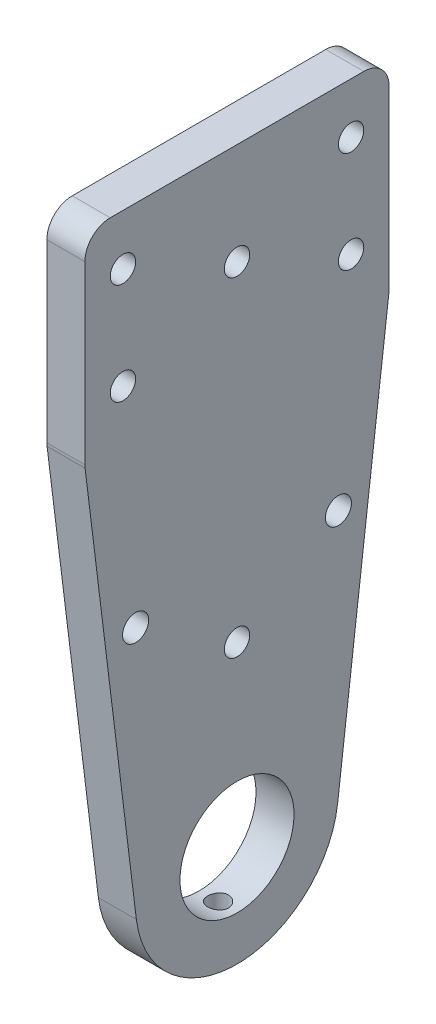
from build123d import *

# Parameters (mm, degrees)
BOSS_EXTRUDE1_START     = -38.1
SKETCH1_R               = 14.2875
SKETCH1_R_2             = 3.175
SKETCH1_R_3             = 3.2639
BOSS_EXTRUDE1_DEPTH     = 9.525
CUT_EXTRUDE1_REACH      = 194.229
CUT_EXTRUDE1_END_RADIUS = 14.2875
SKETCH2_R               = 2.6035
FILLET1_R               = 6.35


with BuildPart() as part:
    # Sketch1 → Boss-Extrude1 (new body)
    with BuildSketch(Plane(origin=(0, 0, 0), x_dir=(0, 0, -1), z_dir=(1, 0, 0)).offset(BOSS_EXTRUDE1_START)):
        with BuildLine():
            Line((-42.525623825, 632.652514423), (-55.415953018, 737.356140976))
            Line((-55.415953018, 737.356140976), (-55.415953018, 788.156140976))
            Line((-55.415953018, 788.156140976), (20.784046982, 788.156140976))
            Line((20.784046982, 788.156140976), (20.784046982, 737.356140976))
            Line((20.784046982, 737.356140976), (7.89371779, 632.652514423))
            ThreePointArc((7.89371779, 632.652514423), (-17.315953018, 610.356140976), (-42.525623825, 632.652514423))
        make_face()
        with Locations((-17.315953018, 635.756140976)):
            Circle(SKETCH1_R, mode=Mode.SUBTRACT)
        with Locations((-45.890953018, 775.456140976)):
            Circle(SKETCH1_R_2, mode=Mode.SUBTRACT)
        with Locations((-17.315953018, 762.756140976)):
            Circle(SKETCH1_R_2, mode=Mode.SUBTRACT)
        with Locations((-45.890953018, 750.056140976)):
            Circle(SKETCH1_R_2, mode=Mode.SUBTRACT)
        with Locations((11.259046982, 750.056140976)):
            Circle(SKETCH1_R_2, mode=Mode.SUBTRACT)
        with Locations((11.259046982, 775.456140976)):
            Circle(SKETCH1_R_2, mode=Mode.SUBTRACT)
        with Locations((8.084046982, 696.081140976)):
            Circle(SKETCH1_R_3, mode=Mode.SUBTRACT)
        with Locations((-17.315953018, 680.206140976)):
            Circle(SKETCH1_R_2, mode=Mode.SUBTRACT)
        with Locations((-42.715953018, 696.081140976)):
            Circle(SKETCH1_R_3, mode=Mode.SUBTRACT)
    extrude(amount=-BOSS_EXTRUDE1_DEPTH)

    # Cut-Extrude1: up to this cylinder (the profile starts outside it)
    cut_extrude1_end = Plane(origin=(-42.8625, 635.756140976, 17.315953018), z_dir=(1, 0, 0)) * Cylinder(CUT_EXTRUDE1_END_RADIUS, 418.033, mode=Mode.PRIVATE)
    # Sketch2 → Cut-Extrude1 (cut, up to the surface)
    with BuildSketch(Plane(origin=(0, 610.356140976, 0), x_dir=(-1, 0, 0), z_dir=(0, -1, 0)), mode=Mode.PRIVATE) as cut_extrude1_sk1:
        with Locations(Location((42.8625, -17.315953018, 0), (0, 0, 90))):
            Circle(SKETCH2_R)
    cut_extrude1_tool1 = extrude(cut_extrude1_sk1.sketch, amount=-CUT_EXTRUDE1_REACH, mode=Mode.PRIVATE) - cut_extrude1_end
    add(cut_extrude1_tool1.solids().sort_by_distance((-42.8625, 610.356141, 17.315953))[0], mode=Mode.SUBTRACT)

    # Fillet1
    fillet1_edges = [part.edges().sort_by_distance(p)[0] for p in [
        (-42.8625, 737.356140976, 55.415953018),
        (-42.8625, 788.156140976, 55.415953018),
        (-42.8625, 788.156140976, -20.784046982),
        (-42.8625, 737.356140976, -20.784046982),
    ]]
    fillet(fillet1_edges, radius=FILLET1_R)


solid = part.part
